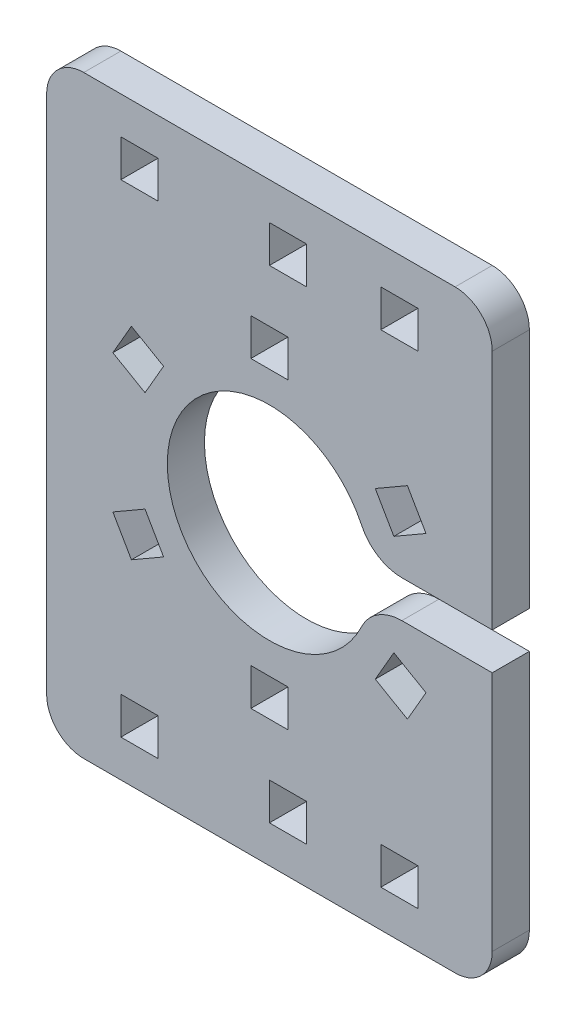
from build123d import *

# Parameters (mm, degrees)
ESQUISSE1_W        = 5
ESQUISSE1_H        = 5
BOSS_EXTRU_1_DEPTH = 5


with BuildPart() as part:
    # Esquisse1 → Boss.-Extru.1 (new body)
    with BuildSketch(Plane.XY):
        with BuildLine():
            Line((-55, 80), (-5, 80))
            ThreePointArc((-5, 80), (-1.464466094, 78.535533906), (0, 75))
            Line((0, 75), (0, 42.5))
            Line((0, 42.5), (-12.172703514, 42.5))
            ThreePointArc((-12.172703514, 42.5), (-15.374759815, 43.42586604), (-17.588591054, 45.917721519))
            ThreePointArc((-17.588591054, 45.917721519), (-43.75, 40), (-17.588591054, 34.082278481))
            ThreePointArc((-17.588591054, 34.082278481), (-15.374759815, 36.57413396), (-12.172703514, 37.5))
            Line((-12.172703514, 37.5), (0, 37.5))
            Line((0, 37.5), (0, 5))
            ThreePointArc((0, 5), (-1.464466094, 1.464466094), (-5, 0))
            Line((-5, 0), (-55, 0))
            ThreePointArc((-55, 0), (-58.535533906, 1.464466094), (-60, 5))
            Line((-60, 5), (-60, 75))
            ThreePointArc((-60, 75), (-58.535533906, 78.535533906), (-55, 80))
        make_face()
        with Locations((-12.5, 72.5)):
            Rectangle(ESQUISSE1_W, ESQUISSE1_H, mode=Mode.SUBTRACT)
        with Locations((-47.5, 7.5)):
            Rectangle(ESQUISSE1_W, ESQUISSE1_H, mode=Mode.SUBTRACT)
        with Locations((-27.5, 7.5)):
            Rectangle(ESQUISSE1_W, ESQUISSE1_H, mode=Mode.SUBTRACT)
        with Locations((-12.5, 7.5)):
            Rectangle(ESQUISSE1_W, ESQUISSE1_H, mode=Mode.SUBTRACT)
        with Locations((-27.5, 72.5)):
            Rectangle(ESQUISSE1_W, ESQUISSE1_H, mode=Mode.SUBTRACT)
        with Locations((-47.5, 72.5)):
            Rectangle(ESQUISSE1_W, ESQUISSE1_H, mode=Mode.SUBTRACT)
        with Locations((-30, 60.4)):
            Rectangle(ESQUISSE1_W, ESQUISSE1_H, mode=Mode.SUBTRACT)
        Polygon((-11.418018253, 53.615063509), (-8.918018253, 49.284936491), (-13.248145272, 46.784936491), (-15.748145272, 51.115063509), align=None, mode=Mode.SUBTRACT)
        Polygon((-8.918018253, 30.715063509), (-11.418018253, 26.384936491), (-15.748145272, 28.884936491), (-13.248145272, 33.215063509), align=None, mode=Mode.SUBTRACT)
        with Locations((-30, 19.6)):
            Rectangle(ESQUISSE1_W, ESQUISSE1_H, mode=Mode.SUBTRACT)
        Polygon((-48.581981747, 26.384936491), (-51.081981747, 30.715063509), (-46.751854728, 33.215063509), (-44.251854728, 28.884936491), align=None, mode=Mode.SUBTRACT)
        Polygon((-51.081981747, 49.284936491), (-48.581981747, 53.615063509), (-44.251854728, 51.115063509), (-46.751854728, 46.784936491), align=None, mode=Mode.SUBTRACT)
    extrude(amount=BOSS_EXTRU_1_DEPTH)


solid = part.part
